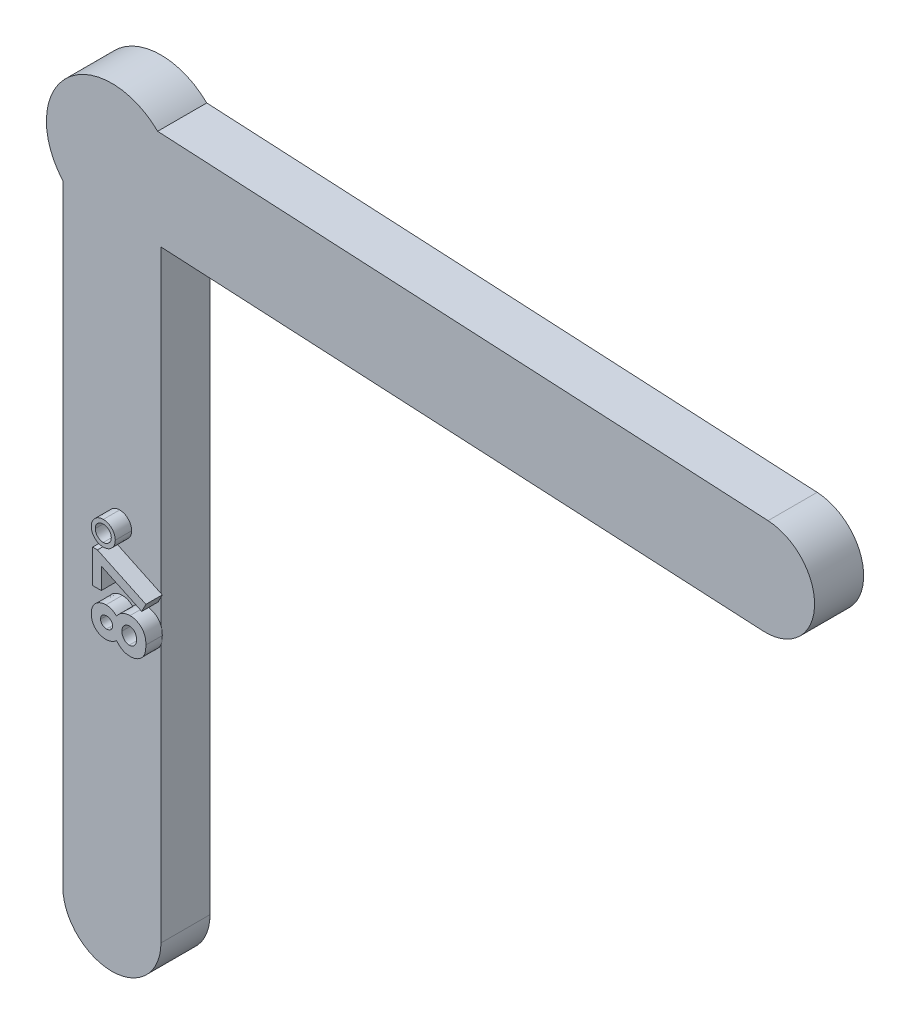
from build123d import *

# Parameters (mm, degrees)
BOSS_EXTRUDE1_DEPTH = 3
BOSS_EXTRUDE2_DEPTH = 1


with BuildPart() as part:
    # Sketch2 → Boss-Extrude1 (new body)
    with BuildSketch(Plane.XY):
        with BuildLine():
            Line((-3, -40), (-3, -2.645751311))
            ThreePointArc((-3, -2.645751311), (-2.753418303, 2.901497484), (2.79913327, 2.857420679))
            Line((2.79913327, 2.857420679), (40.102189259, 0.902450355))
            ThreePointArc((40.102189259, 0.902450355), (42.941069994, -2.250446118), (39.788173521, -5.089326854))
            Line((39.788173521, -5.089326854), (3, -3.161340376))
            Line((3, -3.161340376), (3, -40))
            ThreePointArc((3, -40), (0, -43), (-3, -40))
        make_face()
    extrude(amount=BOSS_EXTRUDE1_DEPTH)

    # Sketch3 → Boss-Extrude2 (add)
    # profile 1 of 3: a face of its own
    with BuildSketch(Plane.XY.offset(3)):
        with BuildLine():
            add(Edge.make_bspline(
                [(1.290384615, -23.053687015), (1.314166509, -23.020383692), (1.361240621, -22.954462768), (1.445595377, -22.867687101), (1.539140341, -22.792282951), (1.642399085, -22.730429644), (1.752431528, -22.680469101), (1.868089089, -22.645111376), (1.988052111, -22.622352496), (2.069615292, -22.619893856), (2.110847356, -22.618650957)],
                knots=[0, 0, 0, 0, 1.013621193, 2.006371702, 2.99000395, 3.985409788, 4.983103806, 5.979189713, 6.978433935, 8, 8, 8, 8], degree=3))
            add(Edge.make_bspline(
                [(2.110847356, -22.618650957), (2.155493061, -22.620156215), (2.244042089, -22.6231417), (2.373883227, -22.649603079), (2.498505826, -22.691863793), (2.616432852, -22.750165481), (2.724431839, -22.822918706), (2.820760825, -22.907251661), (2.901500204, -23.004430616), (2.956541404, -23.094553819), (2.992613836, -23.17242161), (3.017147677, -23.234658245), (3.036374539, -23.301255893), (3.053202037, -23.371222096), (3.065563353, -23.445431472), (3.075401317, -23.523261504), (3.080155908, -23.605266965), (3.08098502, -23.661079409), (3.081410256, -23.689704643)],
                knots=[0, 0, 0, 0, 1.313695232, 2.605545886, 3.885009818, 5.18064216, 6.467307036, 7.710187626, 8.938110693, 10.173834898, 10.807905002, 11.46418112, 12.141763502, 12.847499418, 13.582459421, 14.356129027, 15.156887083, 16, 16, 16, 16], degree=3))
            add(Edge.make_bspline(
                [(3.081410256, -23.689704643), (3.080993787, -23.720238513), (3.080180505, -23.77986514), (3.075321583, -23.866915684), (3.066194522, -23.948997089), (3.054699341, -24.026476108), (3.037672832, -24.098660011), (3.018972292, -24.166638295), (2.996206942, -24.229685711), (2.960636755, -24.306397886), (2.907185797, -24.394867924), (2.828023569, -24.48974541), (2.734597618, -24.574080293), (2.627697323, -24.645889003), (2.509788283, -24.703805454), (2.383511061, -24.746169227), (2.249446964, -24.771449359), (2.157597072, -24.774480144), (2.110847356, -24.776022752)],
                knots=[0, 0, 0, 0, 0.887120363, 1.732371145, 2.531576131, 3.285973923, 4.006155245, 4.684676743, 5.333503306, 5.950809733, 7.13915648, 8.324434623, 9.528022799, 10.783613014, 12.053458699, 13.333110172, 14.642607612, 16, 16, 16, 16], degree=3))
            add(Edge.make_bspline(
                [(2.110847356, -24.776022752), (2.070068436, -24.774607865), (1.989932921, -24.771827439), (1.872494733, -24.751969143), (1.761018818, -24.717702688), (1.654672452, -24.671202674), (1.553870674, -24.61089273), (1.459741575, -24.53625224), (1.370281849, -24.449302159), (1.317458785, -24.383157171), (1.290384615, -24.349254923)],
                knots=[0, 0, 0, 0, 1.018125035, 2.000738969, 2.963689272, 3.92372463, 4.892478514, 5.887985778, 6.917498794, 8, 8, 8, 8], degree=3))
            add(Edge.make_bspline(
                [(1.290384615, -24.349254923), (1.266151716, -24.37026855), (1.218444435, -24.411638052), (1.141646952, -24.465136946), (1.062364505, -24.510431655), (0.981097768, -24.548400131), (0.89711666, -24.576755358), (0.811521784, -24.598330157), (0.723184578, -24.610340491), (0.663516636, -24.612241859), (0.633378405, -24.613202239)],
                knots=[0, 0, 0, 0, 1.061588578, 2.089948196, 3.093099862, 4.082597858, 5.055037947, 6.023898163, 7.001872498, 8, 8, 8, 8], degree=3))
            add(Edge.make_bspline(
                [(0.633378405, -24.613202239), (0.592576327, -24.611942136), (0.512075397, -24.609456001), (0.394207452, -24.587173738), (0.28205246, -24.550687916), (0.176290436, -24.500458322), (0.079075037, -24.437254183), (-0.007396026, -24.361110293), (-0.081993722, -24.273307662), (-0.145475268, -24.174994354), (-0.195029291, -24.066291732), (-0.230531324, -23.948873862), (-0.252811348, -23.823475063), (-0.25519237, -23.737077052), (-0.256410256, -23.692884731)],
                knots=[0, 0, 0, 0, 1.02226196, 2.016883474, 2.9952073, 3.972418565, 4.944004294, 5.893096802, 6.850754418, 7.823909284, 8.818133006, 9.835407617, 10.892817559, 12, 12, 12, 12], degree=3))
            add(Edge.make_bspline(
                [(-0.256410256, -23.692884731), (-0.255190422, -23.649328989), (-0.252812, -23.564404412), (-0.230679106, -23.44120811), (-0.194395909, -23.326336659), (-0.143773179, -23.220034373), (-0.08015754, -23.122743868), (-0.003012872, -23.036443654), (0.085649386, -22.960535668), (0.185372183, -22.896806769), (0.292865784, -22.845560045), (0.405795355, -22.80811499), (0.522920147, -22.786157053), (0.602336048, -22.783039576), (0.642282652, -22.78147147)],
                knots=[0, 0, 0, 0, 1.094451292, 2.133950859, 3.135435022, 4.115505557, 5.085475983, 6.048403322, 7.01637925, 8.011600517, 9.015508126, 10.003420448, 10.995710276, 12, 12, 12, 12], degree=3))
            add(Edge.make_bspline(
                [(0.642282652, -22.78147147), (0.670513068, -22.782230165), (0.725913147, -22.783719047), (0.807533099, -22.79472754), (0.885847553, -22.813264492), (0.962749047, -22.839109199), (1.040327423, -22.875042165), (1.120069223, -22.923667823), (1.205287736, -22.98281455), (1.261061511, -23.02926543), (1.290384615, -23.053687015)],
                knots=[0, 0, 0, 0, 0.940746401, 1.846144481, 2.739104268, 3.619506754, 4.545839139, 5.581956076, 6.728711598, 8, 8, 8, 8], degree=3))
        make_face()
        with BuildLine():
            add(Edge.make_bspline(
                [(0.313461538, -23.706877119), (0.314577296, -23.730348036), (0.316747691, -23.776004156), (0.336791099, -23.84091624), (0.368396801, -23.899808032), (0.413289247, -23.95048958), (0.468001453, -23.991625311), (0.530415435, -24.022361936), (0.600152328, -24.040419717), (0.648960581, -24.042341335), (0.674083534, -24.043330444)],
                knots=[0, 0, 0, 0, 1.01773081, 1.979711282, 2.923920718, 3.903393177, 4.896680191, 5.881555186, 6.909578104, 8, 8, 8, 8], degree=3))
            add(Edge.make_bspline(
                [(0.674083534, -24.043330444), (0.699424417, -24.042113207), (0.748904934, -24.039736434), (0.819934691, -24.021015454), (0.884396564, -23.989182841), (0.940626067, -23.94511674), (0.987659679, -23.892597406), (1.021570733, -23.832248922), (1.04308292, -23.766196373), (1.045116089, -23.719764358), (1.046153846, -23.696064819)],
                knots=[0, 0, 0, 0, 1.070748338, 2.090739333, 3.08117878, 4.090911184, 5.094654374, 6.042199979, 7.000711936, 8, 8, 8, 8], degree=3))
            add(Edge.make_bspline(
                [(1.046153846, -23.696064819), (1.045059816, -23.671963752), (1.042928441, -23.62501035), (1.022508887, -23.558035573), (0.988689983, -23.498240222), (0.94229789, -23.446778141), (0.886359471, -23.403732261), (0.820898298, -23.372882472), (0.747532717, -23.354959732), (0.696233661, -23.35257824), (0.66963141, -23.351343265)],
                knots=[0, 0, 0, 0, 1.009150293, 1.966014103, 2.906107826, 3.870180916, 4.854078599, 5.848854597, 6.884476363, 8, 8, 8, 8], degree=3))
            add(Edge.make_bspline(
                [(0.66963141, -23.351343265), (0.644523092, -23.352612574), (0.595964488, -23.355067373), (0.526250213, -23.372669224), (0.464864053, -23.404995904), (0.410961323, -23.44746899), (0.367492124, -23.500718858), (0.335524613, -23.562538054), (0.316983147, -23.632471368), (0.314660828, -23.681538114), (0.313461538, -23.706877119)],
                knots=[0, 0, 0, 0, 1.065910571, 2.061433587, 3.023559535, 3.990682701, 4.956464619, 5.918590567, 6.925120432, 8, 8, 8, 8], degree=3))
        make_face(mode=Mode.SUBTRACT)
        with BuildLine():
            add(Edge.make_bspline(
                [(1.616025641, -23.688432608), (1.616315036, -23.706264749), (1.616885429, -23.741411677), (1.623711201, -23.79304297), (1.633401384, -23.842793241), (1.648498508, -23.889790787), (1.666134775, -23.935280673), (1.689165374, -23.978114608), (1.715918448, -24.019026505), (1.74640318, -24.057133561), (1.779830517, -24.091584194), (1.814702344, -24.122635493), (1.851910211, -24.148016208), (1.890219827, -24.169152121), (1.929934133, -24.18613499), (1.971707306, -24.19736194), (2.014983002, -24.204590527), (2.044460653, -24.205627754), (2.059329928, -24.206150957)],
                knots=[0, 0, 0, 0, 1.129662435, 2.226550525, 3.296682235, 4.33815786, 5.351414921, 6.385493299, 7.41431807, 8.4469981, 9.473537958, 10.454642902, 11.401552439, 12.321859429, 13.225429467, 14.131893492, 15.057679712, 16, 16, 16, 16], degree=3))
            add(Edge.make_bspline(
                [(2.059329928, -24.206150957), (2.074837113, -24.205901589), (2.105593696, -24.205406998), (2.150485415, -24.197936902), (2.193780386, -24.187181279), (2.235073386, -24.172074677), (2.274340207, -24.151872414), (2.311963245, -24.127750744), (2.347676229, -24.098867615), (2.381297203, -24.066009798), (2.411600958, -24.029214317), (2.438404735, -23.9895988), (2.461677906, -23.947421448), (2.479861546, -23.902281594), (2.49411916, -23.854358323), (2.503888336, -23.803859768), (2.510720881, -23.750522837), (2.511261264, -23.714108221), (2.511538462, -23.695428802)],
                knots=[0, 0, 0, 0, 0.973751152, 1.931314908, 2.852573969, 3.776047714, 4.688004804, 5.623328242, 6.580799242, 7.570383313, 8.573782212, 9.57185612, 10.573837789, 11.596003268, 12.62492379, 13.712263769, 14.826471634, 16, 16, 16, 16], degree=3))
            add(Edge.make_bspline(
                [(2.511538462, -23.695428802), (2.511196157, -23.676544345), (2.510529115, -23.63974452), (2.504633754, -23.585950555), (2.495279457, -23.535071089), (2.481900889, -23.487166539), (2.464761533, -23.442057017), (2.442949692, -23.400343085), (2.418219634, -23.361088923), (2.389368786, -23.325495879), (2.357892778, -23.293285311), (2.323956282, -23.264904421), (2.287463312, -23.241144824), (2.248401199, -23.222262663), (2.207627439, -23.206730386), (2.164524234, -23.195930603), (2.119106345, -23.18941212), (2.087973171, -23.188823698), (2.07205028, -23.188522752)],
                knots=[0, 0, 0, 0, 1.200550576, 2.339492856, 3.436821733, 4.486835684, 5.498320788, 6.499238723, 7.475334368, 8.44385928, 9.406737867, 10.335409062, 11.251568017, 12.168024507, 13.089524389, 14.021419298, 14.988065767, 16, 16, 16, 16], degree=3))
            add(Edge.make_bspline(
                [(2.07205028, -23.188522752), (2.056133401, -23.189104575), (2.025021417, -23.190241837), (1.979077259, -23.196464767), (1.935521469, -23.208138345), (1.893343926, -23.223410811), (1.853417246, -23.243726637), (1.81582637, -23.268948518), (1.779637539, -23.297656376), (1.746471676, -23.331212783), (1.716116677, -23.367889304), (1.689182565, -23.406970419), (1.666011589, -23.448055921), (1.64851655, -23.492154899), (1.633396343, -23.537867798), (1.62371115, -23.586359009), (1.616884013, -23.63672059), (1.616314611, -23.67102381), (1.616025641, -23.688432608)],
                knots=[0, 0, 0, 0, 1.011783362, 1.977685852, 2.938313235, 3.871729441, 4.823627117, 5.776382316, 6.744161804, 7.753880392, 8.768082256, 9.765777265, 10.766741032, 11.757408326, 12.775628261, 13.821889533, 14.89461443, 16, 16, 16, 16], degree=3))
        make_face(mode=Mode.SUBTRACT)
    # profile 2 of 3: a face of its own
    with BuildSketch(Plane.XY.offset(3)):
        Polygon((-0.175, -22.170894547), (-0.175, -20.135638137), (0.120748197, -20.135638137), (3.081410256, -21.536148954), (2.827003205, -22.041146951), (0.354166667, -20.870874515), (0.354166667, -22.170894547), align=None)
    # profile 3 of 3: a face of its own
    with BuildSketch(Plane.XY.offset(3)):
        with BuildLine():
            add(Edge.make_bspline(
                [(0.476282051, -18.344612496), (0.501543872, -18.34515899), (0.55122174, -18.346233683), (0.624352745, -18.356666982), (0.694208258, -18.374146197), (0.761803607, -18.396556844), (0.825395964, -18.427695595), (0.886396731, -18.464557344), (0.943669883, -18.509056179), (0.9978957, -18.558668476), (1.047295391, -18.613168639), (1.090947065, -18.671058995), (1.127096601, -18.732517975), (1.157366856, -18.796230755), (1.180332148, -18.863062169), (1.196689885, -18.932518093), (1.20741609, -19.004890493), (1.208449037, -19.054157378), (1.208974359, -19.079212856)],
                knots=[0, 0, 0, 0, 1.048753193, 2.062393874, 3.059725798, 4.03711221, 5.013824111, 5.993903926, 6.992478922, 8.020738441, 9.043061753, 10.043343452, 11.026424807, 11.999358773, 12.968420071, 13.955122655, 14.960044262, 16, 16, 16, 16], degree=3))
            add(Edge.make_bspline(
                [(1.208974359, -19.079212856), (1.208454225, -19.104270189), (1.207431478, -19.153540721), (1.196631189, -19.225886635), (1.180530583, -19.29550865), (1.156529218, -19.362045198), (1.126678292, -19.425810037), (1.090260147, -19.486726324), (1.046482503, -19.5442545), (0.996781055, -19.598236304), (0.942375086, -19.647761145), (0.88420218, -19.691136419), (0.823225465, -19.728599623), (0.758107997, -19.757490943), (0.69067286, -19.781600545), (0.619758864, -19.797641347), (0.545943315, -19.808486612), (0.495615647, -19.809486592), (0.469921875, -19.809997111)],
                knots=[0, 0, 0, 0, 1.037227242, 2.039512271, 3.023626077, 3.993053151, 4.963434463, 5.936395473, 6.927031705, 7.952593414, 8.972234493, 9.969891786, 10.954906455, 11.929570282, 12.915563215, 13.916770353, 14.936449251, 16, 16, 16, 16], degree=3))
            add(Edge.make_bspline(
                [(0.469921875, -19.809997111), (0.445290866, -19.809464958), (0.396869022, -19.808418804), (0.325492116, -19.797757167), (0.256787066, -19.780836282), (0.190979117, -19.756468736), (0.128167681, -19.725383755), (0.067236284, -19.688833642), (0.010175979, -19.643590918), (-0.044275745, -19.593169229), (-0.093962638, -19.537872015), (-0.137555056, -19.479175886), (-0.173973759, -19.417675527), (-0.203993097, -19.35378793), (-0.227847104, -19.287422069), (-0.244158222, -19.218064726), (-0.254789074, -19.146325039), (-0.255866772, -19.097483519), (-0.256410256, -19.07285268)],
                knots=[0, 0, 0, 0, 1.027628768, 2.020204677, 3.0054932, 3.977172113, 4.942988595, 5.928118098, 6.937247537, 7.976812879, 9.023474825, 10.036014018, 11.024160528, 12.002107364, 12.979092523, 13.962271943, 14.972371232, 16, 16, 16, 16], degree=3))
            add(Edge.make_bspline(
                [(-0.256410256, -19.07285268), (-0.255881051, -19.048219679), (-0.254836181, -18.999583914), (-0.244068832, -18.928080653), (-0.227959354, -18.85909401), (-0.203981879, -18.793177736), (-0.173948227, -18.729938624), (-0.137706982, -18.669154839), (-0.093944483, -18.611595355), (-0.043999627, -18.557672771), (0.009956511, -18.507440689), (0.068273488, -18.464281099), (0.128824771, -18.426758181), (0.192846684, -18.397108571), (0.259342082, -18.373048402), (0.329176204, -18.356887484), (0.401748506, -18.346197063), (0.451226198, -18.345145178), (0.476282051, -18.344612496)],
                knots=[0, 0, 0, 0, 1.02774298, 2.029191086, 3.012479778, 3.981238486, 4.951290381, 5.931946007, 6.930416638, 7.964088953, 8.997761269, 10.003308488, 10.98854748, 11.966603007, 12.943696749, 13.935593372, 14.954569896, 16, 16, 16, 16], degree=3))
        make_face()
        with BuildLine():
            add(Edge.make_bspline(
                [(0.479462139, -18.588843265), (0.462471258, -18.58907777), (0.428972226, -18.589540119), (0.379883793, -18.597159484), (0.332524379, -18.607677282), (0.287283463, -18.622937426), (0.24427911, -18.64288779), (0.203398935, -18.667225335), (0.164484674, -18.695828405), (0.128492582, -18.72889103), (0.095853701, -18.764757353), (0.066652511, -18.802550758), (0.042455186, -18.842740029), (0.023016589, -18.8849266), (0.006315159, -18.928455365), (-0.003707976, -18.974365431), (-0.01154919, -19.021916805), (-0.011966436, -19.054372404), (-0.012179487, -19.070944627)],
                knots=[0, 0, 0, 0, 1.061159961, 2.092171217, 3.098605391, 4.092036902, 5.070589041, 6.057187883, 7.061962211, 8.084674938, 9.107387665, 10.090954379, 11.06617917, 12.032717429, 12.99305519, 13.973669989, 14.965331307, 16, 16, 16, 16], degree=3))
            add(Edge.make_bspline(
                [(-0.012179487, -19.070944627), (-0.01157068, -19.087704919), (-0.01036426, -19.120917302), (-0.004409395, -19.169854338), (0.007572839, -19.216507217), (0.022606002, -19.261708469), (0.043122897, -19.304551649), (0.067542797, -19.346044742), (0.096744971, -19.385088868), (0.129769422, -19.421868172), (0.165718261, -19.45561397), (0.204573602, -19.484604052), (0.244977971, -19.510005915), (0.287582445, -19.530108867), (0.331832846, -19.54622124), (0.377821945, -19.557862933), (0.425871214, -19.564009829), (0.458458137, -19.565174679), (0.475010016, -19.565766342)],
                knots=[0, 0, 0, 0, 1.042034071, 2.064906527, 3.055369705, 4.030203466, 5.020228521, 6.000742353, 7.017744738, 8.043920206, 9.069249762, 10.075703201, 11.051782302, 12.029903876, 12.99669358, 13.974371501, 14.971122288, 16, 16, 16, 16], degree=3))
            add(Edge.make_bspline(
                [(0.475010016, -19.565766342), (0.491349767, -19.565173652), (0.523514051, -19.564006962), (0.570936909, -19.557876669), (0.616468237, -19.546119346), (0.660506807, -19.530078906), (0.703332854, -19.51011189), (0.743356347, -19.483882766), (0.782721478, -19.454672687), (0.819574977, -19.42059183), (0.853594861, -19.383712225), (0.883277913, -19.344216708), (0.908722399, -19.30327591), (0.929101491, -19.260289853), (0.945194342, -19.216027261), (0.956841315, -19.170041459), (0.962986781, -19.121991296), (0.964151827, -19.089404497), (0.96474359, -19.07285268)],
                knots=[0, 0, 0, 0, 1.017878107, 2.003660885, 2.970612419, 3.939454555, 4.919652619, 5.904816436, 6.913406512, 7.969270601, 9.02513469, 10.033724766, 11.041277553, 12.021475617, 12.990317753, 13.970071221, 14.968938047, 16, 16, 16, 16], degree=3))
            add(Edge.make_bspline(
                [(0.96474359, -19.07285268), (0.964515736, -19.056494194), (0.964066668, -19.024253874), (0.956359019, -18.977102396), (0.946146284, -18.931442794), (0.929505189, -18.888139159), (0.910263551, -18.845687405), (0.884925795, -18.805906001), (0.856415485, -18.767049811), (0.822504018, -18.731723164), (0.787116244, -18.697606345), (0.747777121, -18.669419061), (0.707718654, -18.644173655), (0.665616684, -18.623523567), (0.621397497, -18.608716108), (0.575848465, -18.596592987), (0.528165265, -18.590662953), (0.49579822, -18.589453627), (0.479462139, -18.588843265)],
                knots=[0, 0, 0, 0, 1.029744634, 2.029484694, 3.00508751, 3.97324883, 4.947661161, 5.937798898, 6.940036528, 7.980134083, 9.020231638, 10.033191535, 11.023329272, 12.003497406, 12.979740652, 13.958541426, 14.969648588, 16, 16, 16, 16], degree=3))
        make_face(mode=Mode.SUBTRACT)
    extrude(amount=BOSS_EXTRUDE2_DEPTH)


solid = part.part
